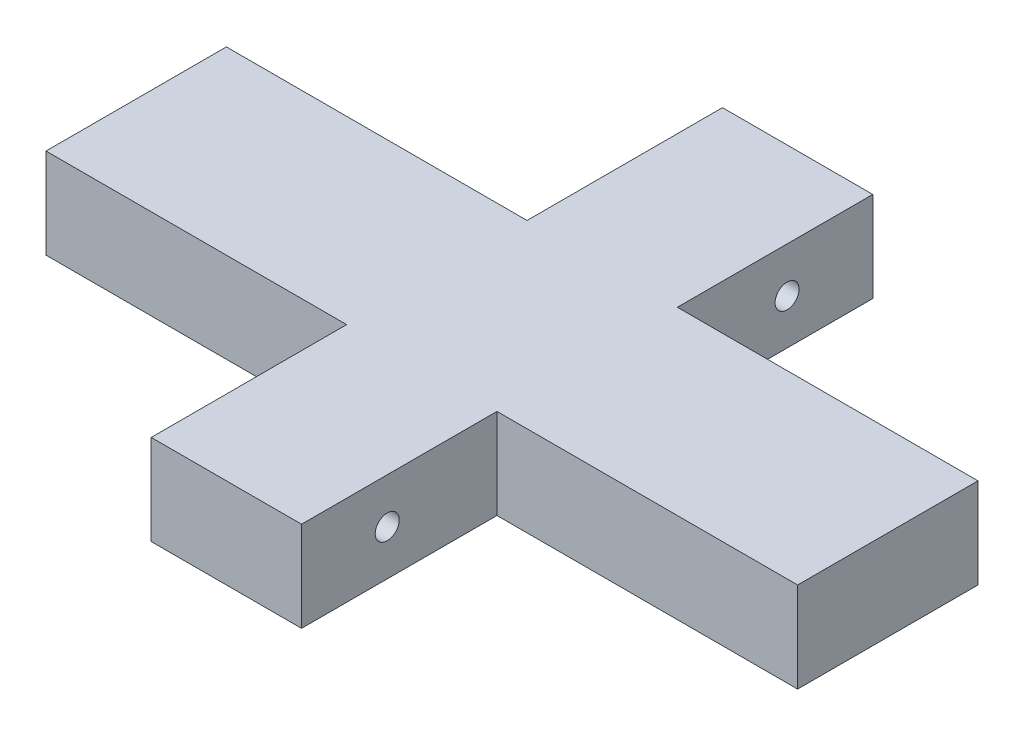
from build123d import *

# Parameters (mm, degrees)
BOSS_EXTRUDE1_DEPTH     = 60
CUT_EXTRUDE1_DEPTH      = 361.138862107
CUT_EXTRUDE1_DEPTH_BACK = 361.138862107
SKETCH2_R               = 8


with BuildPart() as part:
    # Sketch1 → Boss-Extrude1 (new body)
    with BuildSketch(Plane(origin=(0, 0, 0), x_dir=(1, 0, 0), z_dir=(0, 1, 0))):
        Polygon((-250, 60), (-50, 60), (-50, 190), (50, 190), (50, 60), (250, 60), (250, -60), (50, -60), (50, -190), (-50, -190), (-50, -60), (-250, -60), align=None)
    extrude(amount=BOSS_EXTRUDE1_DEPTH)

    # Sketch2 → Cut-Extrude1 (cut, two sides: drawn at the far end of the back side and taken through both)
    with BuildSketch(Plane.ZY.offset(50).offset(-CUT_EXTRUDE1_DEPTH_BACK)):
        with Locations((133, 30)):
            Circle(SKETCH2_R)
        with Locations((-133, 30)):
            Circle(SKETCH2_R)
    extrude(amount=CUT_EXTRUDE1_DEPTH + CUT_EXTRUDE1_DEPTH_BACK, mode=Mode.SUBTRACT)


solid = part.part
